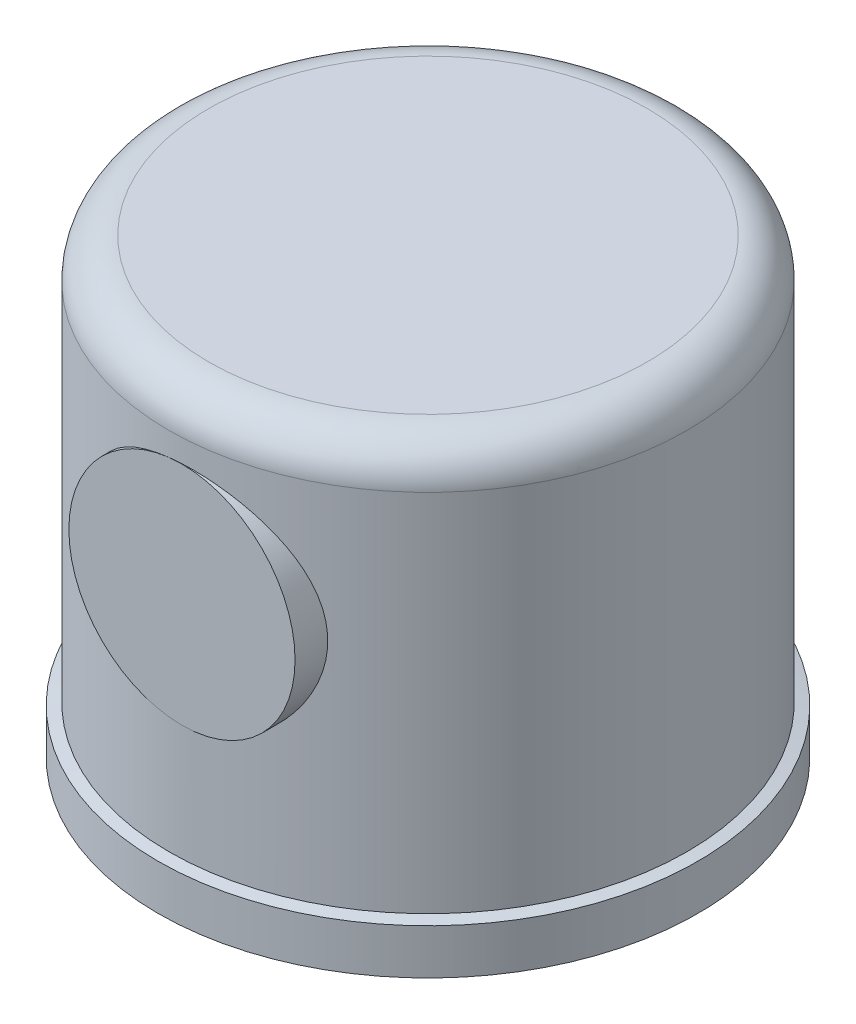
from build123d import *

# Parameters (mm, degrees)
SKETCH4_R           = 10
BOSS_EXTRUDE2_DEPTH = 6


with BuildPart() as part:
    # Sketch1 → Revolve1 (revolve)
    with BuildSketch(Plane.XY, mode=Mode.PRIVATE) as revolve1_sk:
        with BuildLine():
            Line((20.9, 0), (23.871591838, 0))
            Line((23.871591838, 0), (23.871591838, 4))
            Line((23.871591838, 4), (22.9, 4.236662843))
            Line((22.9, 4.236662843), (22.9, 36.5))
            ThreePointArc((22.9, 36.5), (21.874873734, 38.974873734), (19.4, 40))
            Line((19.4, 40), (0, 40))
            Line((0, 40), (0, 38))
            Line((0, 38), (18.9, 38))
            ThreePointArc((18.9, 38), (20.314213562, 37.414213562), (20.9, 36))
            Line((20.9, 36), (20.9, 13.908178136))
            Line((20.9, 13.908178136), (0, 13.908178136))
            Line((0, 13.908178136), (0, 11.908178136))
            Line((0, 11.908178136), (20.9, 11.908178136))
            Line((20.9, 11.908178136), (20.9, 0))
        make_face()
    revolve(revolve1_sk.sketch.rotate(Axis((0, -0.724089275, 0), (0, 1, 0)), 90), axis=Axis((0, -0.724089275, 0), (0, 1, 0)))

    # Sketch4 → Boss-Extrude2 (add)
    with BuildSketch(Plane.XY.offset(22.9)):
        with Locations((1.144629865, 24.5)):
            Circle(SKETCH4_R)
    extrude(amount=-BOSS_EXTRUDE2_DEPTH)


solid = part.part
